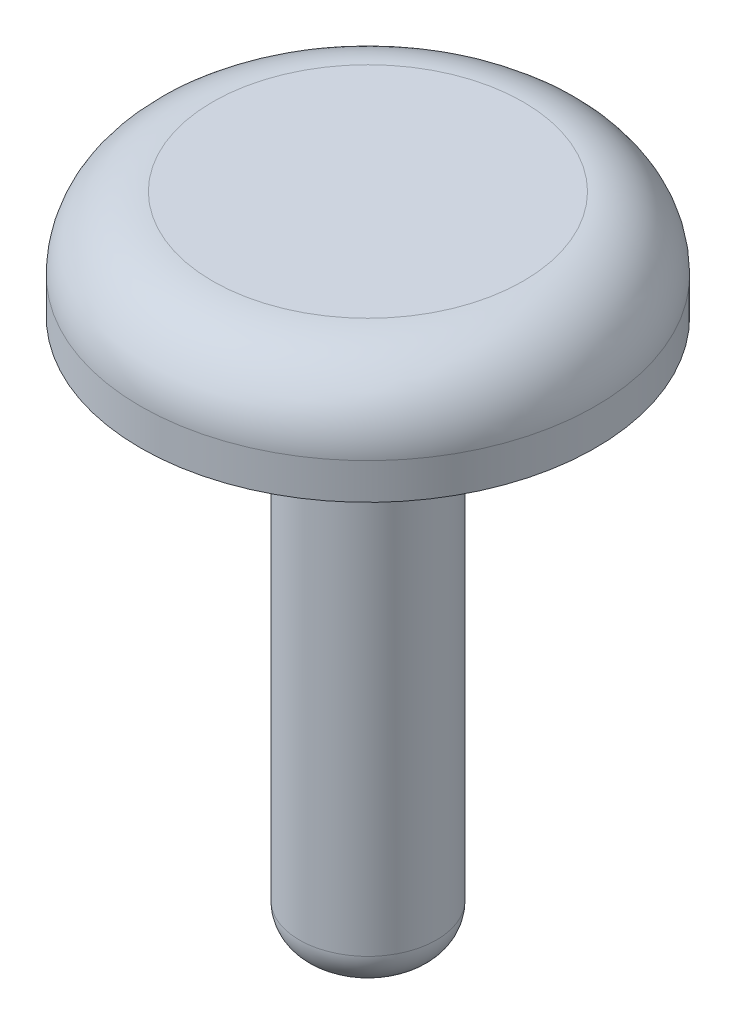
from build123d import *
from build123d.topology import SkipClean

# Parameters (mm, degrees)
CROQUIS1_R                   = 0.95
SALIENTE_EXTRUIR1_DEPTH      = 9
SALIENTE_EXTRUIR2_DEPTH      = 0.0001
SALIENTE_EXTRUIR2_DEPTH_BACK = 1.5
CROQUIS2_R                   = 3.15
REDONDEO3_R                  = 0.5
REDONDEO5_R                  = 1
CROQUIS4_R                   = 2.65
CROQUIS4_R_2                 = 0.95
CORTAR_EXTRUIR4_DEPTH        = 1


with BuildPart() as part:
    # Croquis1 → Saliente-Extruir1 (new body)
    with BuildSketch(Plane(origin=(0, 0, 0), x_dir=(1, 0, 0), z_dir=(0, 1, 0))):
        with Locations(Location((0, 0, 0), (0, 0, 270))):
            Circle(CROQUIS1_R)
    extrude(amount=SALIENTE_EXTRUIR1_DEPTH)

    # Croquis2 → Saliente-Extruir2 (add, two sides: drawn at the far end of the back side and taken through both)
    with BuildSketch(Plane(origin=(0, 9, 0), x_dir=(1, 0, 0), z_dir=(0, 1, 0)).offset(-SALIENTE_EXTRUIR2_DEPTH_BACK)):
        with Locations(Location((0, 0, 0), (0, 0, 270))):
            Circle(CROQUIS2_R)
    extrude(amount=SALIENTE_EXTRUIR2_DEPTH + SALIENTE_EXTRUIR2_DEPTH_BACK)

    # Redondeo3
    redondeo3_edges = [part.edges().sort_by_distance(p)[0] for p in [
        (0, 0, -0.95),
    ]]
    fillet(redondeo3_edges, radius=REDONDEO3_R)

    # Redondeo5
    redondeo5_edges = [part.edges().sort_by_distance(p)[0] for p in [
        (0, 9.0001, -3.15),
    ]]
    fillet(redondeo5_edges, radius=REDONDEO5_R)

    # Croquis4 → Cortar-Extruir4 (cut)
    with SkipClean():  # the faces are left unmerged after this step: merging them gives an invalid solid
        with BuildSketch(Plane(origin=(0, 7.5, 0), x_dir=(-1, 0, 0), z_dir=(0, -1, 0))):
            with Locations(Location((0, 0, 0), (0, 0, 90))):
                Circle(CROQUIS4_R)
            with Locations(Location((0, 0, 0), (0, 0, 90))):
                Circle(CROQUIS4_R_2, mode=Mode.SUBTRACT)
        extrude(amount=-CORTAR_EXTRUIR4_DEPTH, mode=Mode.SUBTRACT)


solid = part.part
